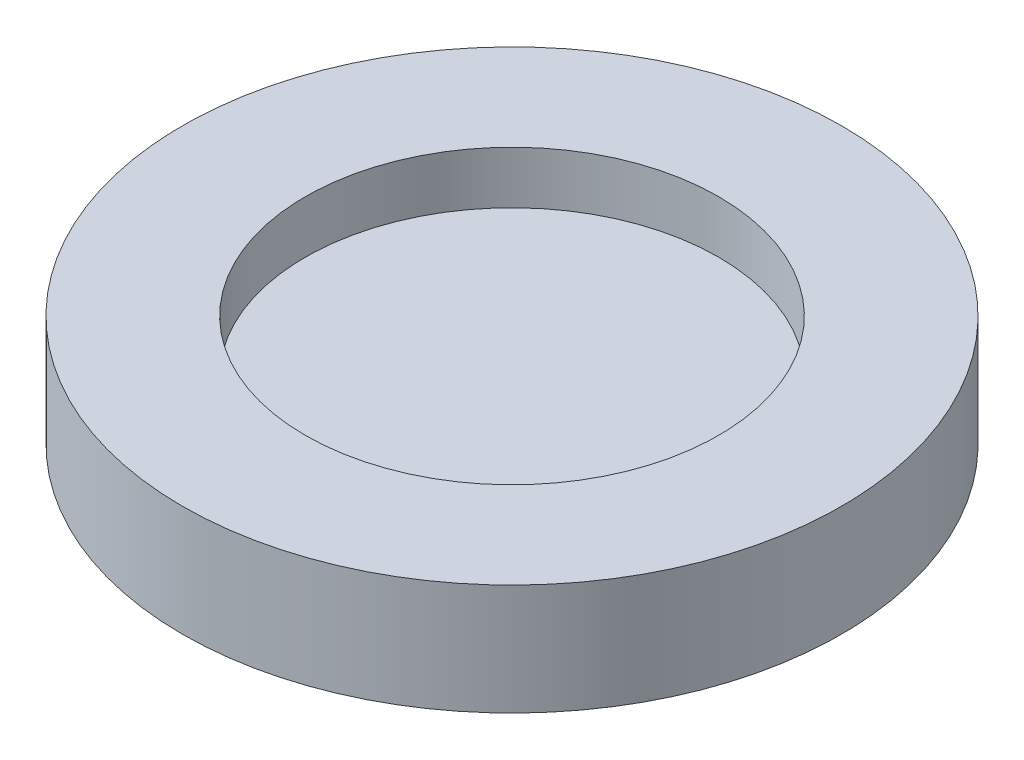
from build123d import *

# Parameters (mm, degrees)
SKETCH1_R                = 11
BOSS_EXTRUDE1_DEPTH      = 3.7
SKETCH2_R                = 6.9
CUT_EXTRUDE1_DEPTH       = 3.7
BOSS_EXTRUDE2_DEPTH      = 0.1
BOSS_EXTRUDE2_DEPTH_BACK = 0.1
SKETCH3_R                = 8.700899362


with BuildPart() as part:
    # Sketch1 → Boss-Extrude1 (new body)
    with BuildSketch(Plane(origin=(0, 0, 0), x_dir=(1, 0, 0), z_dir=(0, 1, 0))):
        with Locations(Location((0, 0, 0), (0, 0, 270))):
            Circle(SKETCH1_R)
    extrude(amount=BOSS_EXTRUDE1_DEPTH)

    # Sketch2 → Cut-Extrude1 (cut)
    with BuildSketch(Plane(origin=(0, 3.7, 0), x_dir=(1, 0, 0), z_dir=(0, 1, 0))):
        with Locations(Location((0, 0, 0), (0, 0, 270))):
            Circle(SKETCH2_R)
    extrude(amount=-CUT_EXTRUDE1_DEPTH, mode=Mode.SUBTRACT)

    # Sketch3 → Boss-Extrude2 (add, two sides: drawn at the far end of the back side and taken through both)
    with BuildSketch(Plane(origin=(0, 1.85, 0), x_dir=(1, 0, 0), z_dir=(0, 1, 0)).offset(-BOSS_EXTRUDE2_DEPTH_BACK)):
        Circle(SKETCH3_R)
    extrude(amount=BOSS_EXTRUDE2_DEPTH + BOSS_EXTRUDE2_DEPTH_BACK)


solid = part.part
